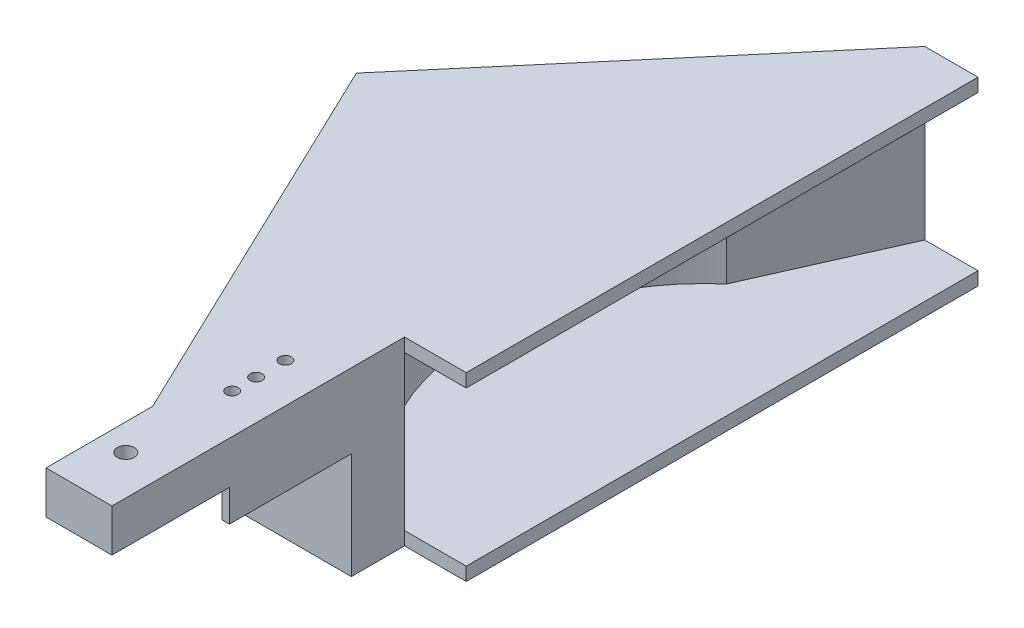
from build123d import *

# Parameters (mm, degrees)
BOSS_EXTRUDE1_DEPTH = 14
SKETCH3_R           = 4.125
CUT_EXTRUDE1_DEPTH  = 6
SKETCH5_R           = 1.125
CUT_EXTRUDE2_DEPTH  = 15
CUT_EXTRUDE5_DEPTH  = 6
CUT_EXTRUDE6_REACH  = 108.478
SKETCH16_R          = 1.6
BOSS_EXTRUDE2_START = 20
BOSS_EXTRUDE2_DEPTH = 20
BOSS_EXTRUDE3_DEPTH = 2.5
BOSS_EXTRUDE4_START = -34
BOSS_EXTRUDE4_DEPTH = 2.5


with BuildPart() as part:
    # Sketch1 → Boss-Extrude1 (new body)
    with BuildSketch(Plane(origin=(0, 0, 0), x_dir=(1, 0, 0), z_dir=(0, 1, 0))):
        with BuildLine():
            Line((47.5, -78.442713945), (47.5, -38.442713945))
            ThreePointArc((47.5, -38.442713945), (23.533579371, -5.900241558), (37.627970881, 31.977851779))
            Line((37.627970881, 31.977851779), (49.091933627, 57.755216031))
            Line((49.091933627, 57.755216031), (0, 0))
            Line((0, 0), (35.1, -73.422380253))
            Line((35.1, -73.422380253), (35.1, -93.442713945))
            Line((35.1, -93.442713945), (37.5, -93.442713945))
            Line((37.5, -93.442713945), (47.5, -93.442713945))
            Line((47.5, -93.442713945), (47.5, -78.442713945))
        make_face()
    extrude(amount=BOSS_EXTRUDE1_DEPTH)

    # Sketch3 → Cut-Extrude1 (cut)
    with BuildSketch(Plane.XZ):
        with BuildLine():
            Line((33.254958794, 84.403112572), (36.18509612, 92.428977457))
            Line((36.18509612, 92.428977457), (44.88509612, 92.428977457))
            Line((44.88509612, 92.428977457), (46.13509612, 88.028977457))
            Line((46.13509612, 88.028977457), (46.13509612, 70.028977457))
            Line((46.13509612, 70.028977457), (44.820911197, 53.062159312))
            ThreePointArc((44.820911197, 53.062159312), (40.059955227, 48.679043991), (35.34566343, 53.112310791))
            Line((35.34566343, 53.112310791), (33.254958794, 84.403112572))
        make_face()
        with Locations(Location((40.08509612, 83.428977457, 0), (0, 0, 90))):
            Circle(SKETCH3_R, mode=Mode.SUBTRACT)
    extrude(amount=-CUT_EXTRUDE1_DEPTH, mode=Mode.SUBTRACT)

    # Sketch5 → Cut-Extrude2 (cut)
    with BuildSketch(Plane.XZ.offset(-6)):
        with Locations(Location((40.08509612, 63.428977457, 0), (0, 0, 270))):
            Circle(SKETCH5_R)
        with Locations(Location((40.08509612, 58.928977457, 0), (0, 0, 270))):
            Circle(SKETCH5_R)
        with Locations(Location((40.08509612, 53.428977457, 0), (0, 0, 270))):
            Circle(SKETCH5_R)
    extrude(amount=-CUT_EXTRUDE2_DEPTH, mode=Mode.SUBTRACT)

    # Sketch15 → Cut-Extrude5 (cut)
    with BuildSketch(Plane(origin=(0, 6, 0), x_dir=(-1, 0, 0), z_dir=(0, -1, 0))):
        Polygon((-32.170978305, -71.382705183), (-57.86059863, -71.382705183), (-57.86059863, -110.098742661), (-30.980040887, -110.098742661), align=None)
    extrude(amount=CUT_EXTRUDE5_DEPTH, mode=Mode.SUBTRACT)

    # Sketch16 → Cut-Extrude6 (cut, up to next)
    with BuildSketch(Plane(origin=(0, 14, 0), x_dir=(1, 0, 0), z_dir=(0, 1, 0)), mode=Mode.PRIVATE) as cut_extrude6_sk1:
        with Locations(Location((40.08509612, -83.428977457, 0), (0, 0, 270))):
            Circle(SKETCH16_R)
    cut_extrude6_tool1 = extrude(cut_extrude6_sk1.sketch, amount=-CUT_EXTRUDE6_REACH, mode=Mode.PRIVATE) & part.part
    add(cut_extrude6_tool1.solids().sort_by_distance((40.085096, 14, 83.428977))[0], mode=Mode.SUBTRACT)

    # Sketch17 → Boss-Extrude2 (add)
    with BuildSketch(Plane(origin=(0, 0, 0), x_dir=(-1, 0, 0), z_dir=(0, -1, 0)).offset(BOSS_EXTRUDE2_START)):
        with BuildLine():
            Line((-37.627970881, 31.977851779), (-49.091933627, 57.755216031))
            Line((-49.091933627, 57.755216031), (0, 0))
            Line((0, 0), (-23.158323847, -48.442713945))
            Line((-23.158323847, -48.442713945), (-47.5, -48.442713945))
            Line((-47.5, -48.442713945), (-47.5, -38.442713945))
            ThreePointArc((-47.5, -38.442713945), (-23.533579371, -5.900241558), (-37.627970881, 31.977851779))
        make_face()
    extrude(amount=-BOSS_EXTRUDE2_DEPTH)

    # Sketch18 → Boss-Extrude3 (add)
    with BuildSketch(Plane(origin=(0, 14, 0), x_dir=(1, 0, 0), z_dir=(0, 1, 0))):
        Polygon((23.122023742, 27.202380873), (49.091933627, 57.755216031), (59.091933627, 57.755216031), (59.091933627, -38.442713945), (23.122023742, -38.442713945), align=None)
    extrude(amount=-BOSS_EXTRUDE3_DEPTH)

    # Sketch18<2> → Boss-Extrude4 (add)
    with BuildSketch(Plane(origin=(0, 14, 0), x_dir=(1, 0, 0), z_dir=(0, 1, 0)).offset(BOSS_EXTRUDE4_START)):
        Polygon((23.122023742, 27.202380873), (49.091933627, 57.755216031), (59.091933627, 57.755216031), (59.091933627, -38.442713945), (23.122023742, -38.442713945), align=None)
    extrude(amount=BOSS_EXTRUDE4_DEPTH)


solid = part.part
